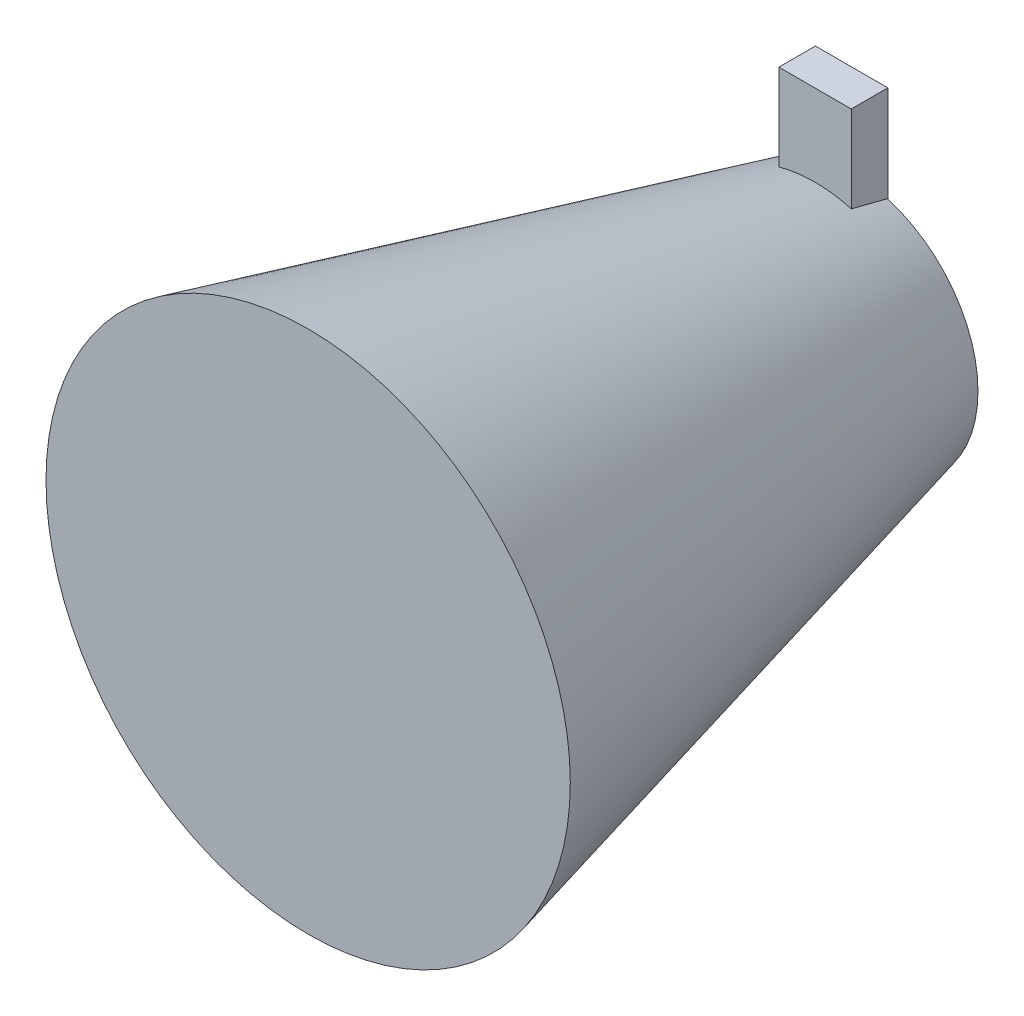
from build123d import *

# Parameters (mm, degrees)
ESQUISSE1_R             = 3.5
BOSS_EXTRU_1_DEPTH      = 15
BOSS_EXTRU_1_DRAFT      = -14
BOSS_EXTRU_2_DEPTH      = 0.01
BOSS_EXTRU_2_DEPTH_BACK = 1
ESQUISSE2_W             = 2
ESQUISSE2_H             = 6


with BuildPart() as part:
    # Esquisse1 → Boss.-Extru.1 (with draft: the straight prism first)
    with BuildSketch(Plane.XY):
        with Locations((-45.645547355, 34.788865837)):
            Circle(ESQUISSE1_R)
    extrude(amount=BOSS_EXTRU_1_DEPTH)
    # Boss.-Extru.1: the draft: its side faces are tilted about the plane it starts from
    boss_extru_1_sides = [part.faces().sort_by_distance(p)[0] for p in [
        (-49.145547355, 34.788865837, 7.5),
    ]]
    draft(boss_extru_1_sides, Plane.XY, BOSS_EXTRU_1_DRAFT)


with BuildPart() as body_2:
    # Esquisse2 → Boss.-Extru.2 (new, two sides: drawn at the far end of the back side and taken through both)
    with BuildSketch(Plane(origin=(0, 0, 0), x_dir=(-1, 0, 0), z_dir=(0, 0, -1)).offset(-BOSS_EXTRU_2_DEPTH_BACK)):
        with Locations((45.645547355, 37.788865837)):
            Rectangle(ESQUISSE2_W, ESQUISSE2_H)
    extrude(amount=BOSS_EXTRU_2_DEPTH + BOSS_EXTRU_2_DEPTH_BACK)


solid = Compound([part.part, body_2.part])
